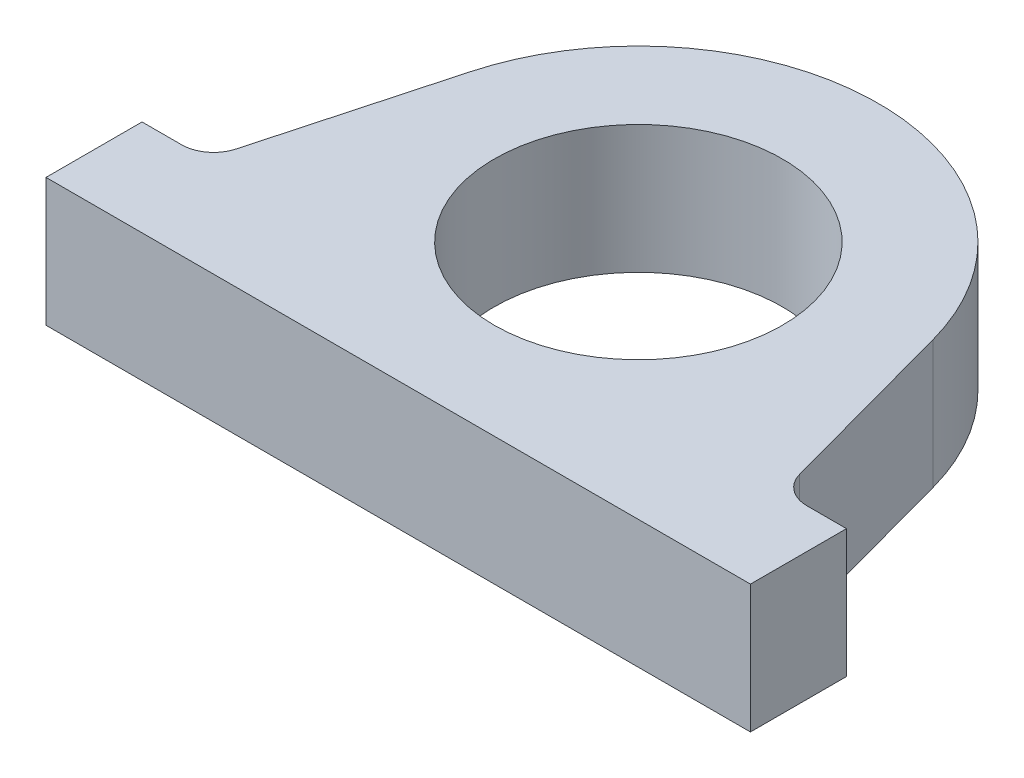
from build123d import *

# Parameters (mm, degrees)
SKETCH_1_R      = 45
EXTRUDE_1_DEPTH = 40
FILLET_1_R      = 10


with BuildPart() as part:
    # 草图1 → 凸台-拉伸1 (new body)
    with BuildSketch(Plane(origin=(0, 0, 0), x_dir=(1, 0, 0), z_dir=(0, 1, 0))):
        with BuildLine():
            Line((110, 0), (-110, 0))
            Line((-110, 0), (-110, 30))
            Line((-110, 30), (-90, 30))
            Line((-90, 30), (-72.360679775, 94.72135955))
            ThreePointArc((-72.360679775, 94.72135955), (0, 150), (72.360679775, 94.72135955))
            Line((72.360679775, 94.72135955), (90, 30))
            Line((90, 30), (110, 30))
            Line((110, 30), (110, 0))
        make_face()
        with Locations(Location((0, 75, 0), (0, 0, 270))):
            Circle(SKETCH_1_R, mode=Mode.SUBTRACT)
    extrude(amount=EXTRUDE_1_DEPTH)

    # 圆角1
    fillet_1_edges = [part.edges().sort_by_distance(p)[0] for p in [
        (-90, 20, -30),
        (90, 20, -30),
    ]]
    fillet(fillet_1_edges, radius=FILLET_1_R)


solid = part.part
